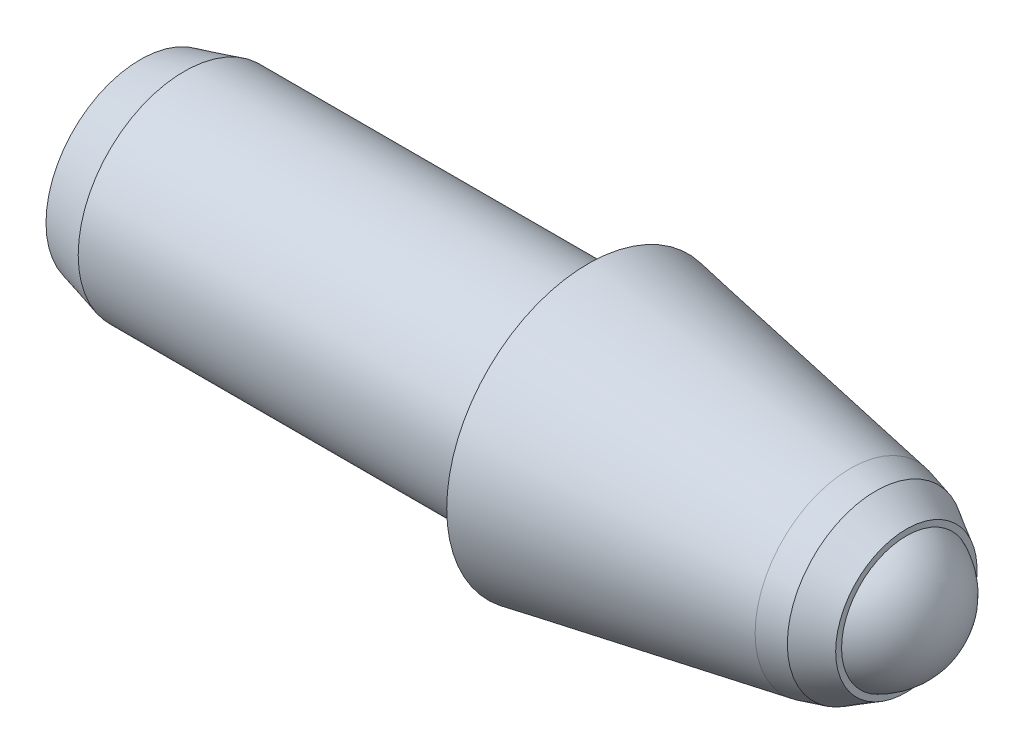
from build123d import *


with BuildPart() as part:
    # Sketch1 → Base-Revolve (revolve)
    with BuildSketch(Plane.XY, mode=Mode.PRIVATE) as base_revolve_sk:
        with BuildLine():
            Line((0, 0.465), (0, 0.8))
            Line((0, 0.8), (0.373205081, 0.9))
            Line((0.373205081, 0.9), (3.8, 0.9))
            Line((3.8, 0.9), (3.8, 1.2))
            Line((3.8, 1.2), (6.024410205, 0.807776465))
            Line((6.024410205, 0.807776465), (6.240034907, 0.75))
            Line((6.240034907, 0.75), (6.5, 0.599909083))
            Line((6.5, 0.599909083), (6.5, 0.549909083))
            ThreePointArc((6.5, 0.549909083), (6.382585786, 0.587343788), (6.26, 0.6))
            Line((6.26, 0.6), (6.011471863, 0.6))
            Line((6.011471863, 0.6), (5.761471863, 0.35))
            Line((5.761471863, 0.35), (5.028867513, 0.35))
            Line((5.028867513, 0.35), (5, 0.4))
            Line((5, 0.4), (3.028867513, 0.4))
            Line((3.028867513, 0.4), (3, 0.45))
            Line((3, 0.45), (0.615, 0.45))
            Line((0.615, 0.45), (0.6, 0.465))
            Line((0.6, 0.465), (0, 0.465))
        make_face()
    revolve(base_revolve_sk.sketch.rotate(Axis((-0.157884346, 0, 0), (1, 0, 0)), 90), axis=Axis((-0.157884346, 0, 0), (1, 0, 0)))


with BuildPart() as body_2:
    # Sketch2 → Esfera (revolve)
    with BuildSketch(Plane.XY):
        with BuildLine():
            Line((5.66, 0), (6.86, 0))
            ThreePointArc((6.86, 0), (6.26, 0.6), (5.66, 0))
        make_face()
    revolve(axis=Axis((4.979736288, 0, 0), (1, 0, 0)))


solid = Compound([part.part, body_2.part])
